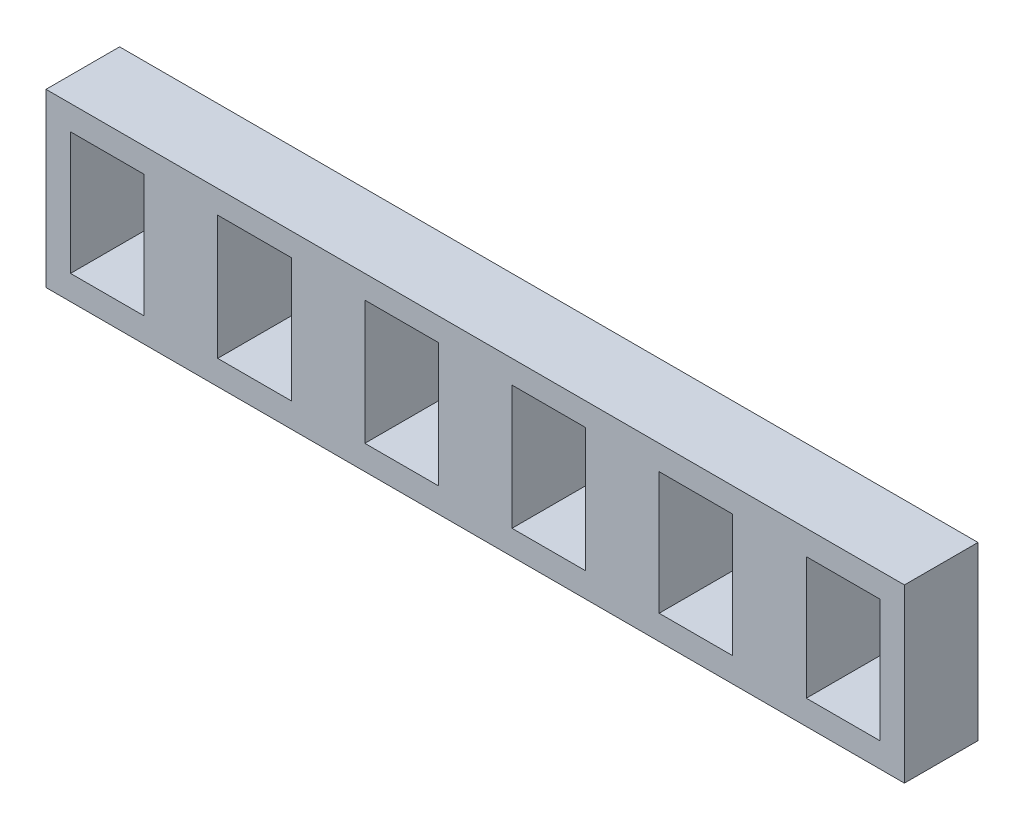
from build123d import *

# Parameters (mm, degrees)
CROQUIS1_W              = 35
CROQUIS1_H              = 7
CROQUIS1_W_2            = 3
CROQUIS1_H_2            = 5
CROQUIS1_H_3            = 5.05796889
SALIENTE_EXTRUIR1_DEPTH = 3


with BuildPart() as part:
    # Croquis1 → Saliente-Extruir1 (new body)
    with BuildSketch(Plane.XY):
        with Locations((-3.377853846, 14.721195761)):
            Rectangle(CROQUIS1_W, CROQUIS1_H)
        with Locations((5.622146154, 14.720695363)):
            Rectangle(CROQUIS1_W_2, CROQUIS1_H_2, mode=Mode.SUBTRACT)
        with Locations((-18.377853846, 14.720695363)):
            Rectangle(CROQUIS1_W_2, CROQUIS1_H_2, mode=Mode.SUBTRACT)
        with Locations((11.622146154, 14.720695363)):
            Rectangle(CROQUIS1_W_2, CROQUIS1_H_2, mode=Mode.SUBTRACT)
        with Locations((-12.377853846, 14.749679808)):
            Rectangle(CROQUIS1_W_2, CROQUIS1_H_3, mode=Mode.SUBTRACT)
        with Locations((-6.377853846, 14.749679808)):
            Rectangle(CROQUIS1_W_2, CROQUIS1_H_3, mode=Mode.SUBTRACT)
        with Locations((-0.377853846, 14.749679808)):
            Rectangle(CROQUIS1_W_2, CROQUIS1_H_3, mode=Mode.SUBTRACT)
    extrude(amount=SALIENTE_EXTRUIR1_DEPTH)


solid = part.part
